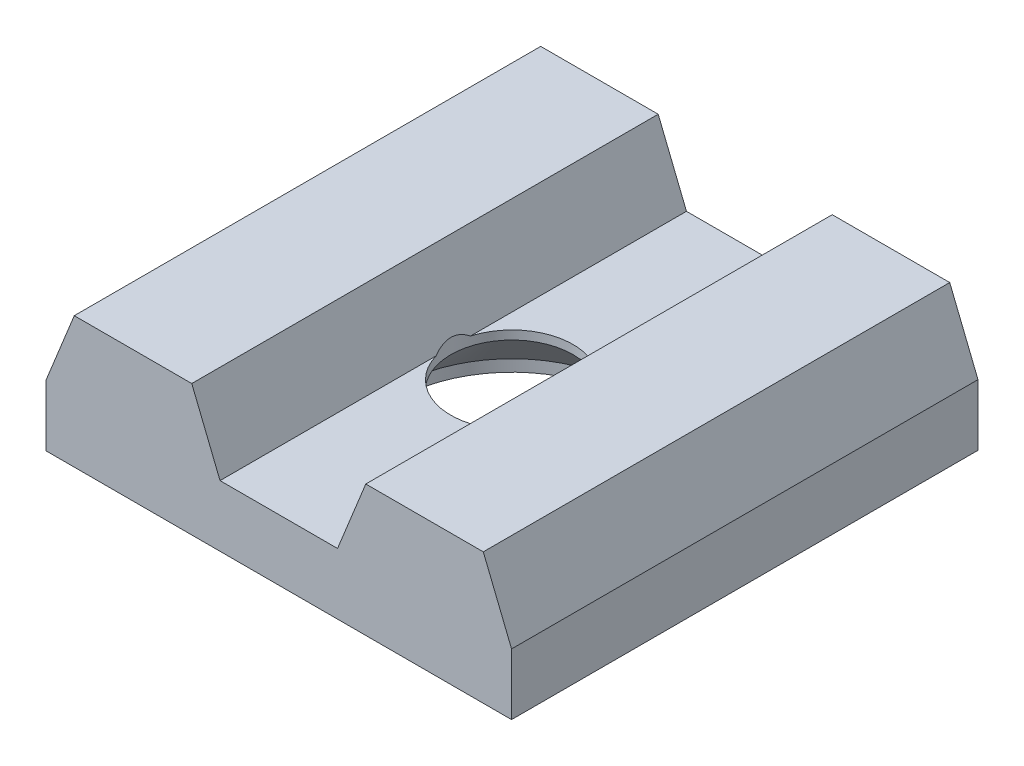
from build123d import *

# Parameters (mm, degrees)
EXTRUDE_1_DEPTH     = 8
SKETCH_2_R          = 1.05
CUT_EXTRUDE_1_DEPTH = 10.283823749
CHAMFER_1_SIZE      = 0.25


with BuildPart() as part:
    # ｽｹｯﾁ1 → ﾎﾞｽ - 押し出し1 (new body)
    with BuildSketch(Plane.XY):
        Polygon((-3.507584264, 0), (-1.492415736, 0), (-1.007584264, -1.2), (1.007584264, -1.2), (1.492415736, 0), (3.507584264, 0), (3.992415736, -1.2), (3.992415736, -2.5), (-3.992415736, -2.5), (-3.992415736, -1.2), align=None)
    extrude(amount=EXTRUDE_1_DEPTH)

    # ｽｹｯﾁ2 → ｶｯﾄ - 押し出し1 (cut, through all)
    with BuildSketch(Plane.XZ.offset(2.5)):
        with Locations((0, 4)):
            Circle(SKETCH_2_R)
    extrude(amount=-CUT_EXTRUDE_1_DEPTH, mode=Mode.SUBTRACT)

    # ｽｹｯﾁ4 → ｶｯﾄ - 回転1 (revolve, cut)
    with BuildSketch(Plane(origin=(0, 0, 0), x_dir=(0, 0, -1), z_dir=(1, 0, 0))):
        Polygon((-4, -2.5), (-2, -2.5), (-2, -2.3), (-3, -1.3), (-4, -1.3), align=None)
    revolve(axis=Axis((0, -2.5, 4), (0, 1, 0)), mode=Mode.SUBTRACT)

    # 面取り1
    chamfer_1_edges = [part.edges().sort_by_distance(p)[0] for p in [
        (3.992415736, -2.5, 4),
        (-3.992415736, -2.5, 4),
        (0, -2.5, 8),
        (0, -2.5, 0),
    ]]
    chamfer(chamfer_1_edges, length=CHAMFER_1_SIZE)


solid = part.part
